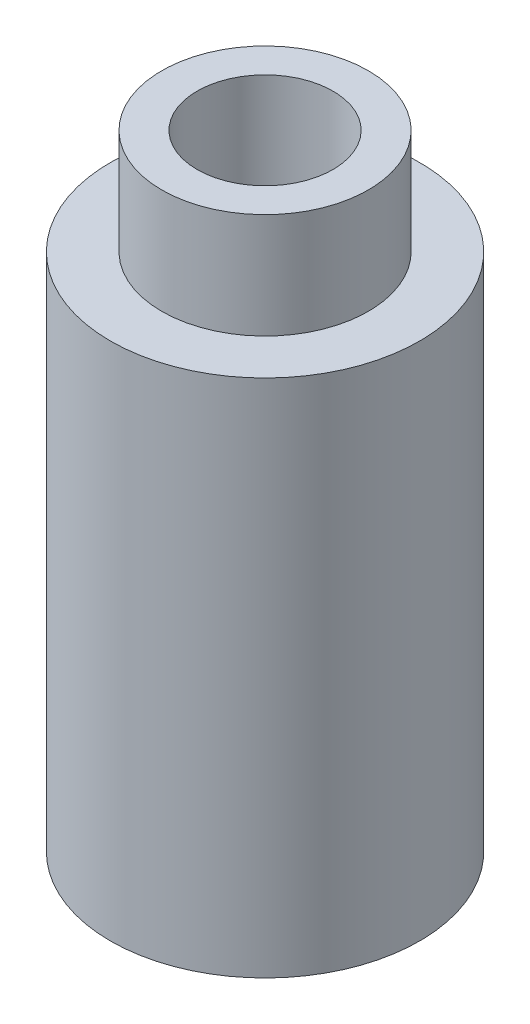
from build123d import *

# Parameters (mm, degrees)
SKETCH1_R           = 9.4488
BOSS_EXTRUDE1_DEPTH = 31.75
SKETCH2_R           = 6.3119
BOSS_EXTRUDE2_DEPTH = 6.4262
SKETCH3_R           = 4.1529
CUT_EXTRUDE1_DEPTH  = 41.447272953


with BuildPart() as part:
    # Sketch1 → Boss-Extrude1 (new body)
    with BuildSketch(Plane(origin=(0, 0, 0), x_dir=(1, 0, 0), z_dir=(0, 1, 0))):
        with Locations(Location((0, 0, 0), (0, 0, 270))):
            Circle(SKETCH1_R)
    extrude(amount=BOSS_EXTRUDE1_DEPTH)

    # Sketch2 → Boss-Extrude2 (add)
    with BuildSketch(Plane(origin=(0, 31.75, 0), x_dir=(1, 0, 0), z_dir=(0, 1, 0))):
        with Locations(Location((0, 0, 0), (0, 0, 270))):
            Circle(SKETCH2_R)
    extrude(amount=BOSS_EXTRUDE2_DEPTH)

    # Sketch3 → Cut-Extrude1 (cut, through all)
    with BuildSketch(Plane(origin=(0, 38.1762, 0), x_dir=(1, 0, 0), z_dir=(0, 1, 0))):
        with Locations(Location((0, 0, 0), (0, 0, 270))):
            Circle(SKETCH3_R)
    extrude(amount=-CUT_EXTRUDE1_DEPTH, mode=Mode.SUBTRACT)


solid = part.part
